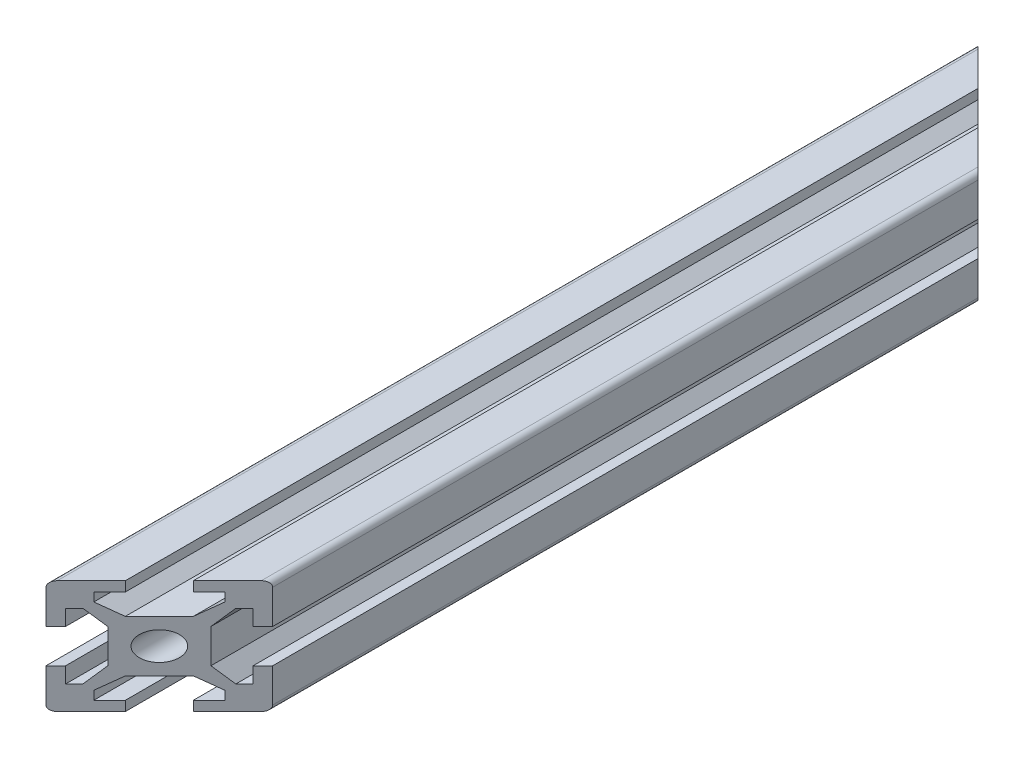
from build123d import *

# Parameters (mm, degrees)
BOSS_EXTRUDE1_DEPTH     = 82.23
CUT_EXTRUDE1_DEPTH      = 166.066930668
CUT_EXTRUDE1_DEPTH_BACK = 166.066930668
SKETCH2_R               = 2.5
FILLET1_R               = 1
SKETCH3_W               = 42.278905999
SKETCH3_H               = 22
CUT_EXTRUDE2_DEPTH      = 128.405385483
SKETCH4_W               = 35
SKETCH4_H               = 22.104489803
CUT_EXTRUDE3_DEPTH      = 128.405385483


with BuildPart() as part:
    # Sketch1 → Boss-Extrude1 (new, symmetric)
    with BuildSketch(Plane.XY):
        Polygon((-10, 10), (-3, 10), (-3, 8.272610059), (-5.783778863, 8.272610059), (-5.783778863, 6.747994248), (-3, 4.550753814), (3, 4.550753814), (5.783778863, 6.747994248), (5.783778863, 8.272610059), (3, 8.272610059), (3, 10), (10, 10), (10, 3), (8.272610059, 3), (8.272610059, 5.783778863), (6.747994248, 5.783778863), (4.55, 3.000595152), (4.55, -2.999404848), (6.747994248, -5.783778863), (8.272610059, -5.783778863), (8.272610059, -3), (10, -3), (10, -10), (3, -10), (3, -8.272610059), (5.783778863, -8.272610059), (5.783778863, -6.747994248), (2.999404848, -4.55), (-3.000595152, -4.55), (-5.783778863, -6.747994248), (-5.783778863, -8.272610059), (-3, -8.272610059), (-3, -10), (-10, -10), (-10, -3), (-8.272610059, -3), (-8.272610059, -5.783778863), (-6.747994248, -5.783778863), (-4.55, -3.000595152), (-4.55, 2.999404848), (-6.747994248, 5.783778863), (-8.272610059, 5.783778863), (-8.272610059, 3), (-10, 3), align=None)
    extrude(amount=BOSS_EXTRUDE1_DEPTH, both=True)

    # Sketch2 → Cut-Extrude1 (cut, two sides: drawn at the far end of the back side and taken through both)
    with BuildSketch(Plane.XY.offset(82.23).offset(-CUT_EXTRUDE1_DEPTH_BACK)):
        Circle(SKETCH2_R)
    extrude(amount=CUT_EXTRUDE1_DEPTH + CUT_EXTRUDE1_DEPTH_BACK, mode=Mode.SUBTRACT)

    # Fillet1
    fillet1_edges = [part.edges().sort_by_distance(p)[0] for p in [
        (-10, 10, 0),
        (10, 10, 0),
        (10, -10, 0),
        (-10, -10, 0),
    ]]
    fillet(fillet1_edges, radius=FILLET1_R)

    # Sketch3 → Cut-Extrude2 (cut, through all)
    with BuildSketch(Plane(origin=(36.115, 0, -36.115), x_dir=(0.7071067811865477, 0, 0.7071067811865475), z_dir=(-0.7071067811865475, 0, 0.7071067811865477))):
        with Locations((-49.240441639, 0.067646977)):
            Rectangle(SKETCH3_W, SKETCH3_H)
    extrude(amount=-CUT_EXTRUDE2_DEPTH, mode=Mode.SUBTRACT)

    # Sketch4 → Cut-Extrude3 (cut, through all)
    with BuildSketch(Plane(origin=(36.115, 0, 36.115), x_dir=(-0.7071067811865477, 0, 0.7071067811865475), z_dir=(-0.7071067811865475, 0, -0.7071067811865477))):
        with Locations((52.605568003, 0.016996688)):
            Rectangle(SKETCH4_W, SKETCH4_H)
    extrude(amount=-CUT_EXTRUDE3_DEPTH, mode=Mode.SUBTRACT)


solid = part.part
